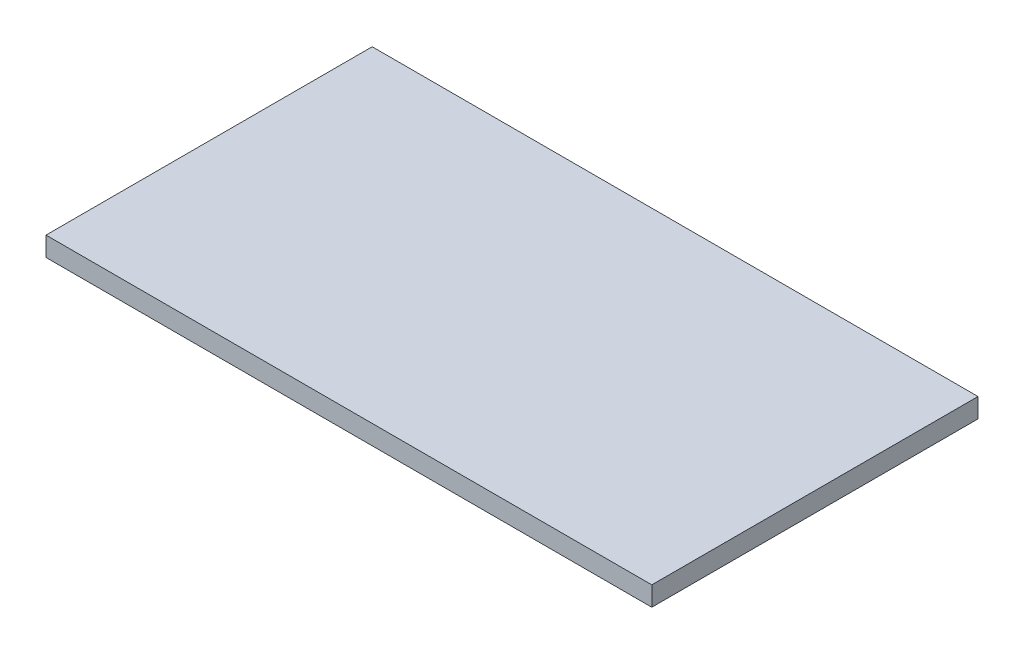
from build123d import *

# Parameters (mm, degrees)
SKETCH1_W           = 39.624
SKETCH1_H           = 21.336
BOSS_EXTRUDE1_DEPTH = 1.27


with BuildPart() as part:
    # Sketch1 → Boss-Extrude1 (new body)
    with BuildSketch(Plane(origin=(0, 0, 0), x_dir=(1, 0, 0), z_dir=(0, 1, 0))):
        with Locations((19.812, 10.668)):
            Rectangle(SKETCH1_W, SKETCH1_H)
    extrude(amount=-BOSS_EXTRUDE1_DEPTH)


solid = part.part
